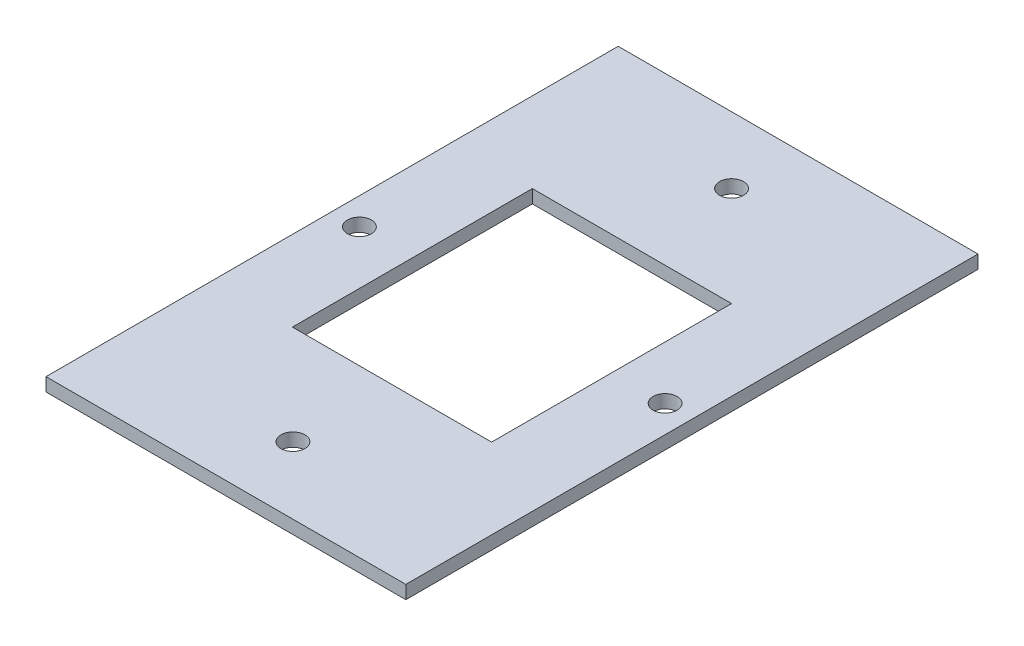
from build123d import *

# Parameters (mm, degrees)
SKETCH1_W           = 54.14
SKETCH1_H           = 86.1
BOSS_EXTRUDE1_DEPTH = 2
SKETCH3_R           = 1.8
SKETCH3_W           = 29.974558808
SKETCH3_H           = 36.1
CUT_EXTRUDE1_DEPTH  = 2


with BuildPart() as part:
    # Sketch1 → Boss-Extrude1 (new body)
    with BuildSketch(Plane(origin=(0, 0, 0), x_dir=(1, 0, 0), z_dir=(0, 1, 0))):
        Rectangle(SKETCH1_W, SKETCH1_H)
    extrude(amount=BOSS_EXTRUDE1_DEPTH)

    # Sketch3 → Cut-Extrude1 (cut)
    with BuildSketch(Plane(origin=(0, 2, 0), x_dir=(1, 0, 0), z_dir=(0, 1, 0))):
        with Locations(Location((22.987279404, 0.05, 0), (0, 0, 270))):
            Circle(SKETCH3_R)
        with Locations(Location((-0.012720596, 33.05, 0), (0, 0, 270))):
            Circle(SKETCH3_R)
        with Locations(Location((-0.012720596, -32.95, 0), (0, 0, 270))):
            Circle(SKETCH3_R)
        with Locations(Location((-23.012720596, 0.05, 0), (0, 0, 270))):
            Circle(SKETCH3_R)
        Rectangle(SKETCH3_W, SKETCH3_H)
    extrude(amount=-CUT_EXTRUDE1_DEPTH, mode=Mode.SUBTRACT)


solid = part.part
